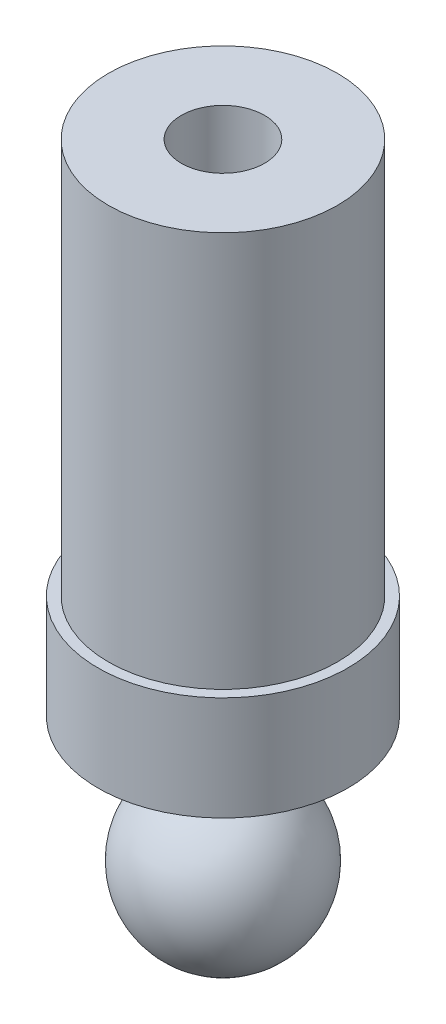
from build123d import *

# Parameters (mm, degrees)
SKETCH1_R           = 6
BOSS_EXTRUDE1_DEPTH = 45
SKETCH7_W           = 15
SKETCH7_H           = 15
CUT_EXTRUDE5_DEPTH  = 25
SKETCH4_R           = 6
SKETCH4_R_2         = 5.5
CUT_EXTRUDE6_DEPTH  = 38
SKETCH5_R           = 2
CUT_EXTRUDE7_DEPTH  = 56
SKETCH8_R           = 2
BOSS_EXTRUDE2_DEPTH = 3


with BuildPart() as part:
    # Sketch1 → Boss-Extrude1 (new body)
    with BuildSketch(Plane(origin=(0, 0, 0), x_dir=(1, 0, 0), z_dir=(0, 1, 0))):
        with Locations(Location((0, 0, 0), (0, 0, 90))):
            Circle(SKETCH1_R)
    extrude(amount=BOSS_EXTRUDE1_DEPTH)

    # Sketch7 → Cut-Extrude5 (cut)
    with BuildSketch(Plane(origin=(0, 24, 0), x_dir=(1, 0, 0), z_dir=(0, 1, 0))):
        Rectangle(SKETCH7_W, SKETCH7_H)
    extrude(amount=CUT_EXTRUDE5_DEPTH, mode=Mode.SUBTRACT)

    # Sketch4 → Cut-Extrude6 (cut)
    with BuildSketch(Plane(origin=(0, 5, 0), x_dir=(1, 0, 0), z_dir=(0, 1, 0))):
        with Locations(Location((0, 0, 0), (0, 0, 90))):
            Circle(SKETCH4_R)
        with Locations(Location((0, 0, 0), (0, 0, 270))):
            Circle(SKETCH4_R_2, mode=Mode.SUBTRACT)
    extrude(amount=CUT_EXTRUDE6_DEPTH, mode=Mode.SUBTRACT)

    # Sketch5 → Cut-Extrude7 (cut)
    with BuildSketch(Plane(origin=(0, 45, 0), x_dir=(1, 0, 0), z_dir=(0, 1, 0))):
        with Locations(Location((0, 0, 0), (0, 0, 270))):
            Circle(SKETCH5_R)
    extrude(amount=-CUT_EXTRUDE7_DEPTH, mode=Mode.SUBTRACT)


with BuildPart() as body_2:
    # Sketch8 → Boss-Extrude2 (new body)
    with BuildSketch(Plane.XZ):
        with Locations(Location((0, 0, 0), (0, 0, 270))):
            Circle(SKETCH8_R)
    extrude(amount=BOSS_EXTRUDE2_DEPTH)

    # Sketch9 → Revolve2 (revolve)
    with BuildSketch(Plane(origin=(0, -6, 0), x_dir=(1, 0, 0), z_dir=(0, 1, 0))):
        with BuildLine():
            Line((-4, 0), (4, 0))
            ThreePointArc((4, 0), (0, 4), (-4, 0))
        make_face()
    revolve(axis=Axis((-4, -6, 0), (1, 0, 0)))


solid = Compound([part.part, body_2.part])
